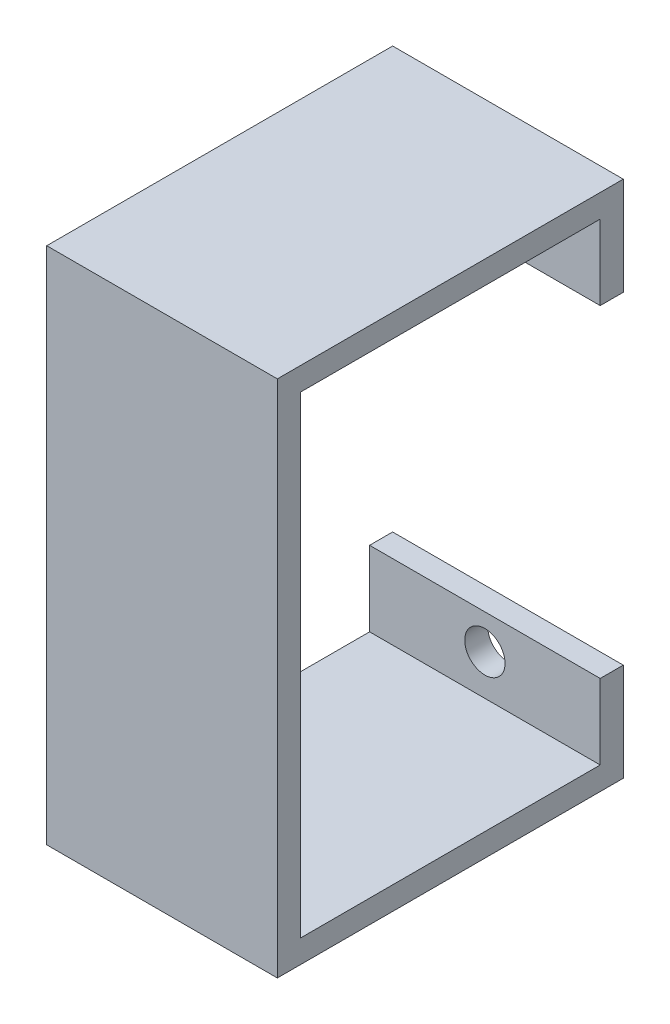
from build123d import *

# Parameters (mm, degrees)
BOSS_EXTRUDE1_DEPTH = 10
SKETCH5_R           = 1.75
CUT_EXTRUDE2_DEPTH  = 38.286056375


with BuildPart() as part:
    # Sketch3 → Boss-Extrude1 (new, symmetric)
    with BuildSketch(Plane(origin=(0, 0, 0), x_dir=(0, 0, -1), z_dir=(1, 0, 0))):
        Polygon((0, -14), (0, -22.5), (-30, -22.5), (-30, 22.5), (0, 22.5), (0, 14), (-2, 14), (-2, 20.5), (-28, 20.5), (-28, -20.5), (-2, -20.5), (-2, -14), align=None)
    extrude(amount=BOSS_EXTRUDE1_DEPTH, both=True)

    # Sketch5 → Cut-Extrude2 (cut, through all)
    with BuildSketch(Plane.XY.offset(2)):
        with Locations((0, -17)):
            Circle(SKETCH5_R)
        with Locations(Location((0, 17, 0), (0, 0, 180))):
            Circle(SKETCH5_R)
    extrude(amount=-CUT_EXTRUDE2_DEPTH, mode=Mode.SUBTRACT)


solid = part.part
